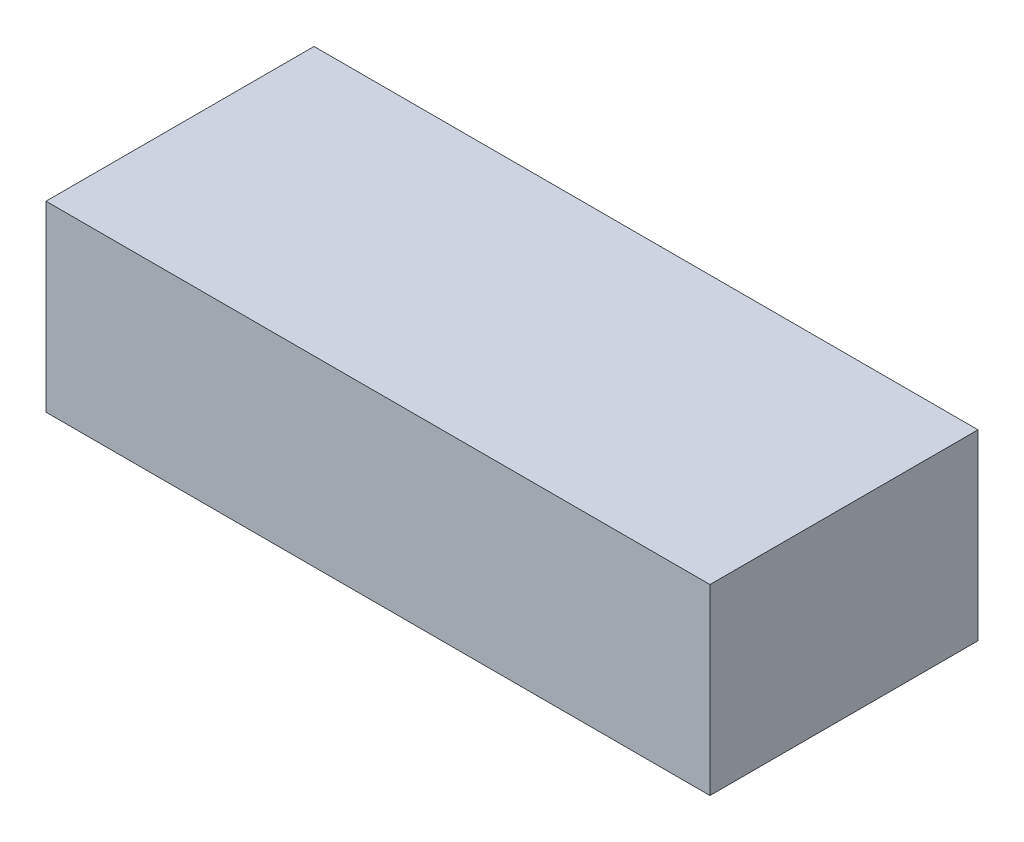
from build123d import *

# Parameters (mm, degrees)
SKETCH1_W           = 218
SKETCH1_H           = 88
BOSS_EXTRUDE1_DEPTH = 60


with BuildPart() as part:
    # Sketch1 → Boss-Extrude1 (new body)
    with BuildSketch(Plane(origin=(0, 0, 0), x_dir=(1, 0, 0), z_dir=(0, 1, 0))):
        with Locations((109, 44)):
            Rectangle(SKETCH1_W, SKETCH1_H)
    extrude(amount=BOSS_EXTRUDE1_DEPTH)


solid = part.part
